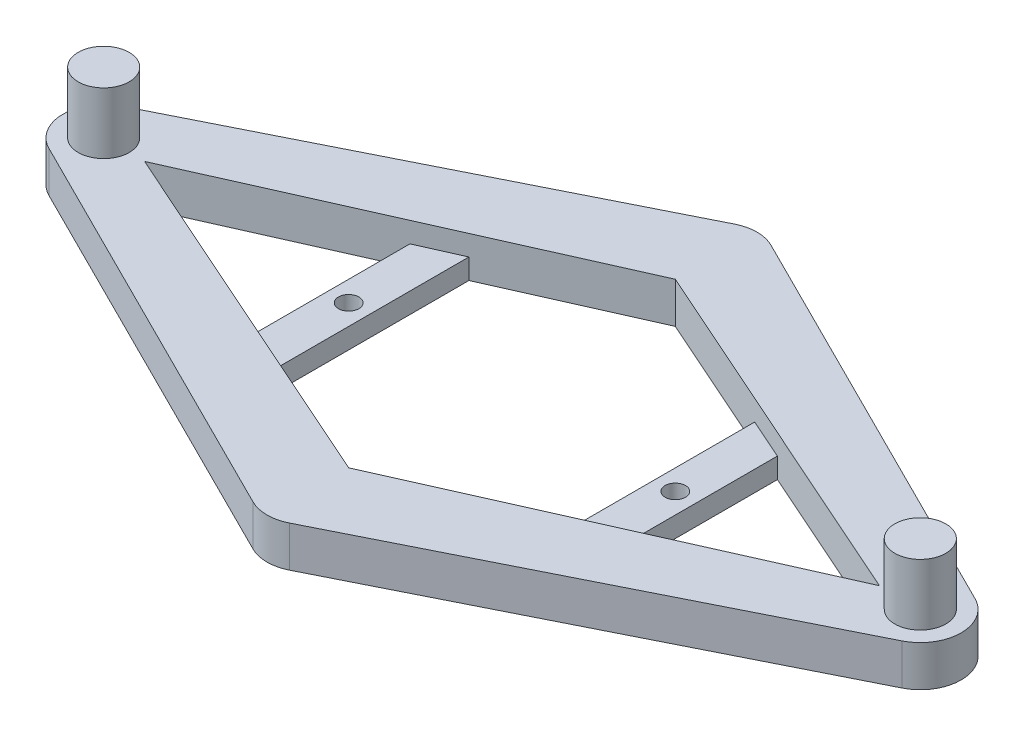
from build123d import *

# Parameters (mm, degrees)
SKETCH5_R             = 1.27
BOSS_EXTRUDE2_DEPTH   = 2.54
BOSS_EXTRUDE2_2_DEPTH = 2.54
BOSS_EXTRUDE1_DEPTH   = 5.08
SKETCH6_R             = 3.175
BOSS_EXTRUDE3_DEPTH   = 7.62


with BuildPart() as part:
    # Sketch5 → Boss-Extrude2 (new body)
    with BuildSketch(Plane(origin=(0, 0, 0), x_dir=(1, 0, 0), z_dir=(0, 1, 0))):
        Polygon((-22.86, 10.16), (-22.86, -10.16), (-17.78, -12.417777778), (-17.78, 12.417777778), align=None)
        with Locations(Location((-20.32, 0, 0), (0, 0, 270))):
            Circle(SKETCH5_R, mode=Mode.SUBTRACT)
    extrude(amount=BOSS_EXTRUDE2_DEPTH)



with BuildPart() as body_2:
    # Sketch5 → Boss-Extrude2 2 (new body)
    with BuildSketch(Plane(origin=(0, 0, 0), x_dir=(1, 0, 0), z_dir=(0, 1, 0))):
        Polygon((22.86, 10.16), (17.78, 12.417777778), (17.78, -12.417777778), (22.86, -10.16), align=None)
        with Locations(Location((20.32, 0, 0), (0, 0, 90))):
            Circle(SKETCH5_R, mode=Mode.SUBTRACT)
    extrude(amount=BOSS_EXTRUDE2_2_DEPTH)


with BuildPart() as part_1:
    add(part.part)

    add(body_2.part)  # Boss-Extrude1 merges body 2
    # Sketch2 → Boss-Extrude1 (add)
    with BuildSketch(Plane(origin=(0, 0, 0), x_dir=(1, 0, 0), z_dir=(0, 1, 0))):
        with BuildLine():
            Line((-53.071845065, -4.54369013), (-2.271845065, -29.94369013))
            ThreePointArc((-2.271845065, -29.94369013), (0, -30.48), (2.271845065, -29.94369013))
            Line((2.271845065, -29.94369013), (53.071845065, -4.54369013))
            ThreePointArc((53.071845065, -4.54369013), (55.88, 0), (53.071845065, 4.54369013))
            Line((53.071845065, 4.54369013), (2.271845065, 29.94369013))
            ThreePointArc((2.271845065, 29.94369013), (0, 30.48), (-2.271845065, 29.94369013))
            Line((-2.271845065, 29.94369013), (-53.071845065, 4.54369013))
            ThreePointArc((-53.071845065, 4.54369013), (-55.88, 0), (-53.071845065, -4.54369013))
        make_face()
        Polygon((-45.72, 0), (0, 20.32), (45.72, 0), (0, -20.32), align=None, mode=Mode.SUBTRACT)
    extrude(amount=BOSS_EXTRUDE1_DEPTH)

    # Sketch6 → Boss-Extrude3 (add)
    with BuildSketch(Plane(origin=(0, 5.08, 0), x_dir=(1, 0, 0), z_dir=(0, 1, 0))):
        with Locations(Location((-50.8, 0, 0), (0, 0, 90))):
            Circle(SKETCH6_R)
        with Locations(Location((50.8, 0, 0), (0, 0, 90))):
            Circle(SKETCH6_R)
    extrude(amount=BOSS_EXTRUDE3_DEPTH)


solid = part_1.part
